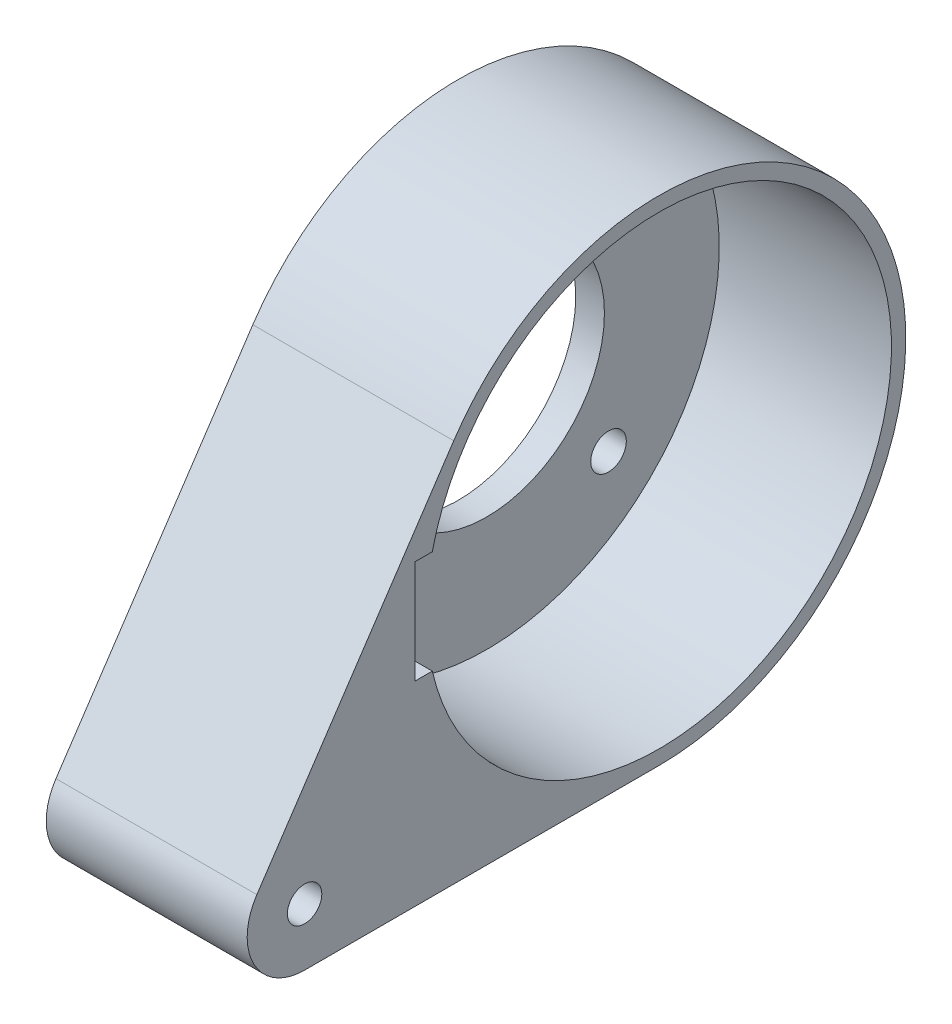
from build123d import *
from build123d.topology import SkipClean

# Parameters (mm, degrees)
EXTRUDE_1_DEPTH     = 2.5
SKETCH_3_R          = 10.25
SKETCH_3_R_2        = 1.55
CUT_EXTRUDE_1_DEPTH = 2.5
SKETCH_2_R          = 20.25
EXTRUDE_2_DEPTH     = 15
SKETCH_4_R          = 1.5
CUT_EXTRUDE_2_DEPTH = 46.33118669
CUT_EXTRUDE_3_DEPTH = 11


with BuildPart() as part:
    # Эскиз1 → Бобышка-Вытянуть1 (new body)
    with BuildSketch(Plane(origin=(0, 0, 0), x_dir=(0, 0, -1), z_dir=(1, 0, 0))):
        with BuildLine():
            Line((-30.866648668, -21.5), (0, -21.5))
            ThreePointArc((0, -21.5), (18.960941325, 10.135714286), (-17.877458963, 11.943469388))
            Line((-17.877458963, 11.943469388), (-35.024197264, -13.72244898))
            ThreePointArc((-35.024197264, -13.72244898), (-35.276169906, -18.857142857), (-30.866648668, -21.5))
        make_face()
    extrude(amount=EXTRUDE_1_DEPTH)

    # Эскиз3 → Вырез-Вытянуть1 (cut)
    with BuildSketch(Plane(origin=(2.5, 0, 0), x_dir=(0, 0, -1), z_dir=(1, 0, 0))):
        Circle(SKETCH_3_R)
        with Locations((3.882285677, 14.488887394)):
            Circle(SKETCH_3_R_2)
        with Locations((10.606601718, -10.606601718)):
            Circle(SKETCH_3_R_2)
        with Locations((-14.488887394, -3.882285677)):
            Circle(SKETCH_3_R_2)
    extrude(amount=-CUT_EXTRUDE_1_DEPTH, mode=Mode.SUBTRACT)

    # Эскиз2 → Бобышка-Вытянуть2 (add)
    with SkipClean():  # the faces are left unmerged after this step: merging them gives an invalid solid
        with BuildSketch(Plane.ZY.offset(-2.5)):
            with BuildLine():
                Line((0, -21.5), (30.866648668, -21.5))
                ThreePointArc((30.866648668, -21.5), (35.276169906, -18.857142857), (35.024197264, -13.72244898))
                Line((35.024197264, -13.72244898), (17.877458963, 11.943469388))
                ThreePointArc((17.877458963, 11.943469388), (-18.960941325, 10.135714286), (0, -21.5))
            make_face()
            Circle(SKETCH_2_R, mode=Mode.SUBTRACT)
        extrude(amount=-EXTRUDE_2_DEPTH)

    # Эскиз4 → Вырез-Вытянуть2 (cut, through all)
    with SkipClean():  # the faces are left unmerged after this step: merging them gives an invalid solid
        with BuildSketch(Plane(origin=(17.5, 0, 0), x_dir=(0, 0, -1), z_dir=(1, 0, 0))):
            with Locations((-30.866648668, -16.5)):
                Circle(SKETCH_4_R)
        extrude(amount=-CUT_EXTRUDE_2_DEPTH, mode=Mode.SUBTRACT)

    # Эскиз5 → Вырез-Вытянуть3 (cut)
    with SkipClean():  # the faces are left unmerged after this step: merging them gives an invalid solid
        with BuildSketch(Plane(origin=(17.5, 0, 0), x_dir=(0, 0, -1), z_dir=(1, 0, 0))):
            Polygon((-20.25, 4.5), (-19.743669872, 4.5), (-19.743669872, -4.5), (-20.25, -4.5), (-21.25, -4.5), (-21.25, 4.5), align=None)
        extrude(amount=-CUT_EXTRUDE_3_DEPTH, mode=Mode.SUBTRACT)


solid = part.part
